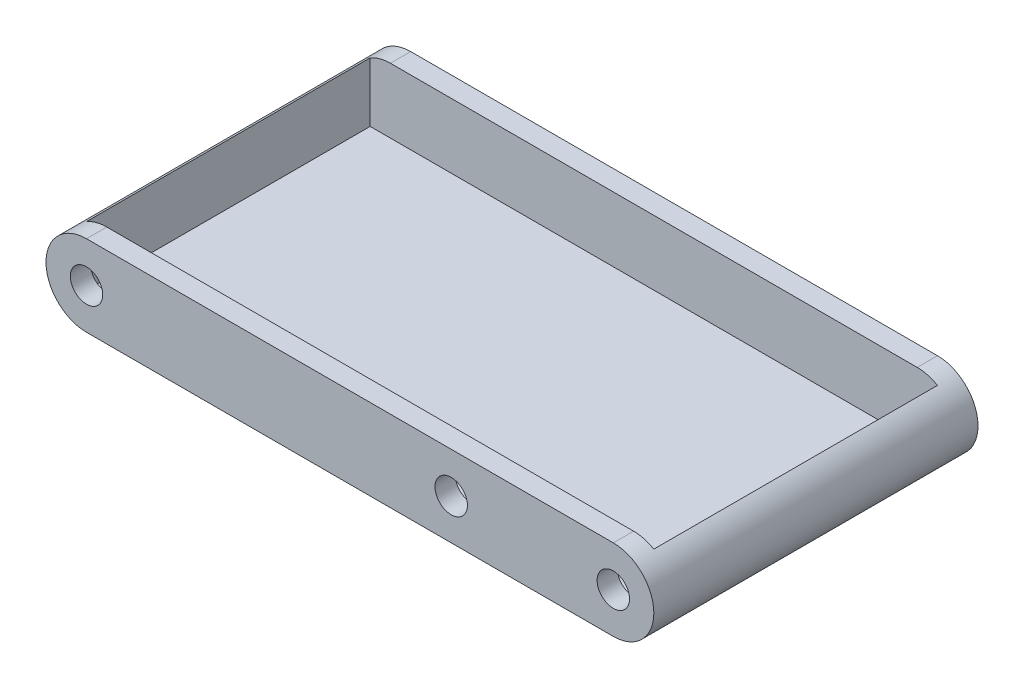
from build123d import *

# Parameters (mm, degrees)
BOSS_EXTRUDE1_DEPTH      = 40
BOSS_EXTRUDE1_DEPTH_BACK = 40
SKETCH2_W                = 140
SKETCH2_H                = 70
CUT_EXTRUDE1_DEPTH       = 16
SKETCH3_R                = 4
CUT_EXTRUDE2_DEPTH       = 5


with BuildPart() as part:
    # Sketch1 → Boss-Extrude1 (new, two sides: drawn at the far end of the back side and taken through both)
    with BuildSketch(Plane.XY.offset(-BOSS_EXTRUDE1_DEPTH_BACK)):
        with BuildLine():
            Line((-65, 10), (65, 10))
            ThreePointArc((65, 10), (75, 0), (65, -10))
            Line((65, -10), (-65, -10))
            ThreePointArc((-65, -10), (-75, 0), (-65, 10))
        make_face()
    extrude(amount=BOSS_EXTRUDE1_DEPTH + BOSS_EXTRUDE1_DEPTH_BACK)

    # Sketch2 → Cut-Extrude1 (cut)
    with BuildSketch(Plane(origin=(0, 10, 0), x_dir=(1, 0, 0), z_dir=(0, 1, 0))):
        Rectangle(SKETCH2_W, SKETCH2_H)
    extrude(amount=-CUT_EXTRUDE1_DEPTH, mode=Mode.SUBTRACT)

    # Sketch3 → Cut-Extrude2 (cut)
    with BuildSketch(Plane.XY.offset(40)):
        with Locations((65, 0)):
            Circle(SKETCH3_R)
        with Locations((-65, 0)):
            Circle(SKETCH3_R)
        with Locations((25, 0)):
            Circle(SKETCH3_R)
    extrude(amount=-CUT_EXTRUDE2_DEPTH, mode=Mode.SUBTRACT)


solid = part.part
